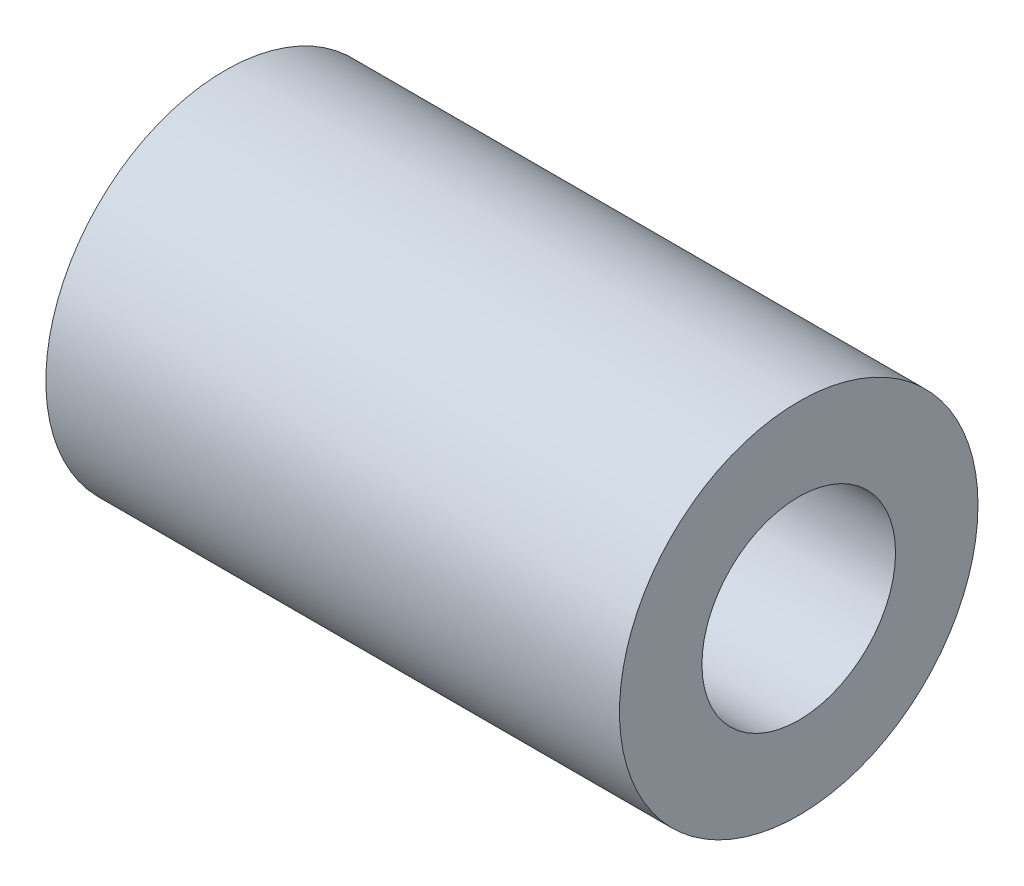
from build123d import *

# Parameters (mm, degrees)
SKETCH_1_R      = 7.5
SKETCH_1_R_2    = 4.05
EXTRUDE_1_DEPTH = 24


with BuildPart() as part:
    # Эскиз1 → Бобышка-Вытянуть1 (new body)
    with BuildSketch(Plane(origin=(0, 0, 0), x_dir=(0, 0, -1), z_dir=(1, 0, 0))):
        Circle(SKETCH_1_R)
        Circle(SKETCH_1_R_2, mode=Mode.SUBTRACT)
    extrude(amount=EXTRUDE_1_DEPTH)


solid = part.part
